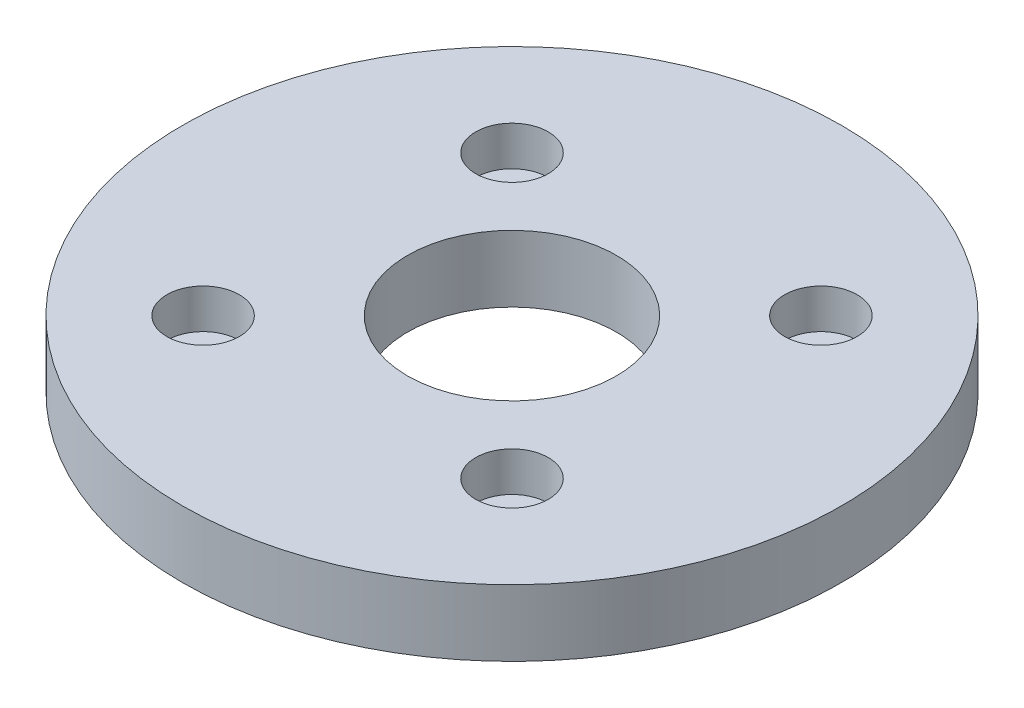
from build123d import *

# Parameters (mm, degrees)
SKETCH_1_R          = 17.35
SKETCH_1_R_2        = 5.5
EXTRUDE_1_DEPTH     = 3.5
SKETCH_6_R          = 1
CUT_EXTRUDE_3_DEPTH = 5
SKETCH_7_R          = 1.91
CUT_EXTRUDE_4_DEPTH = 2.08


with BuildPart() as part:
    # 草图1 → 凸台-拉伸1 (new body)
    with BuildSketch(Plane(origin=(0, 0, 0), x_dir=(1, 0, 0), z_dir=(0, 1, 0))):
        with Locations(Location((0, 0, 0), (0, 0, 270))):
            Circle(SKETCH_1_R)
        with Locations(Location((0, 0, 0), (0, 0, 270))):
            Circle(SKETCH_1_R_2, mode=Mode.SUBTRACT)
    extrude(amount=EXTRUDE_1_DEPTH)

    # 草图6 → 切除-拉伸3 (cut, symmetric)
    with BuildSketch(Plane(origin=(0, 0, 0), x_dir=(1, 0, 0), z_dir=(0, 1, 0))):
        with Locations(Location((8.131727984, 8.131727984, 0), (0, 0, 270))):
            Circle(SKETCH_6_R)
        with Locations(Location((7.424621202, -7.424621202, 0), (0, 0, 270))):
            Circle(SKETCH_6_R)
        with Locations(Location((-8.131727984, -8.131727984, 0), (0, 0, 270))):
            Circle(SKETCH_6_R)
        with Locations(Location((-7.424621202, 7.424621202, 0), (0, 0, 270))):
            Circle(SKETCH_6_R)
    extrude(amount=CUT_EXTRUDE_3_DEPTH, both=True, mode=Mode.SUBTRACT)

    # 草图7 → 切除-拉伸4 (cut)
    with BuildSketch(Plane(origin=(0, 3.5, 0), x_dir=(1, 0, 0), z_dir=(0, 1, 0))):
        with Locations(Location((-7.424621202, 7.424621202, 0), (0, 0, 270))):
            Circle(SKETCH_7_R)
        with Locations(Location((8.131727984, 8.131727984, 0), (0, 0, 270))):
            Circle(SKETCH_7_R)
        with Locations(Location((7.424621202, -7.424621202, 0), (0, 0, 270))):
            Circle(SKETCH_7_R)
        with Locations(Location((-8.131727984, -8.131727984, 0), (0, 0, 270))):
            Circle(SKETCH_7_R)
    extrude(amount=-CUT_EXTRUDE_4_DEPTH, mode=Mode.SUBTRACT)


solid = part.part
